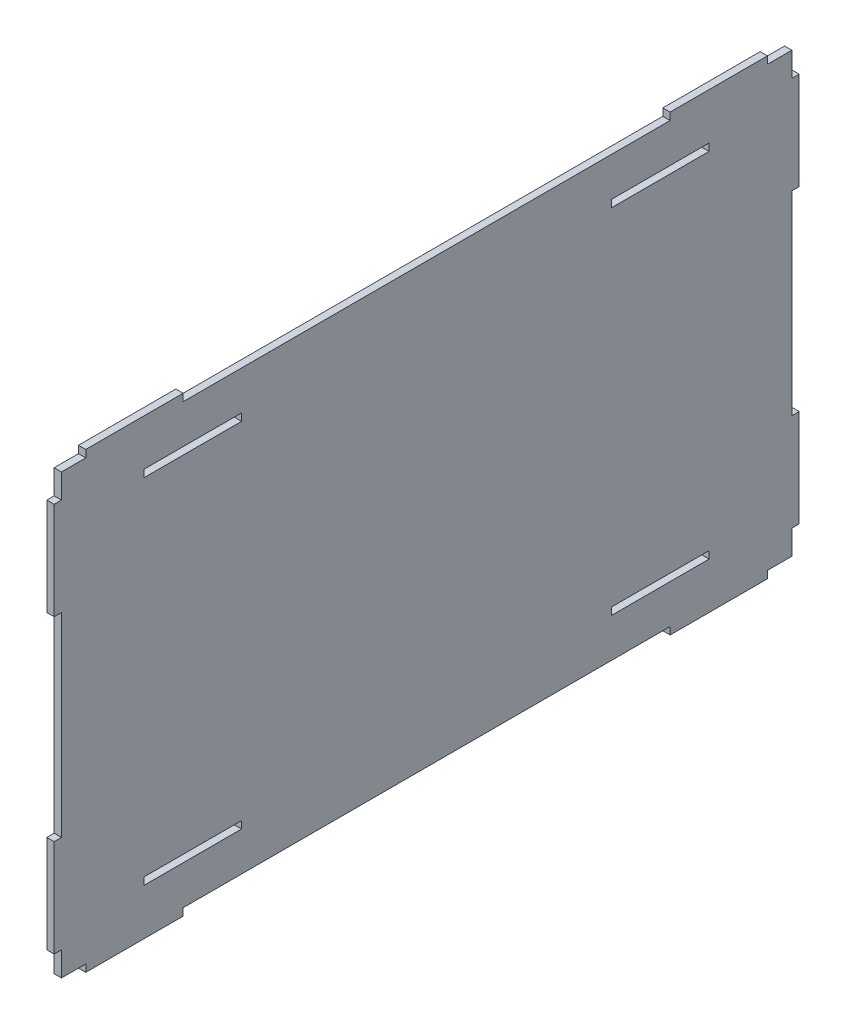
from build123d import *

# Parameters (mm, degrees)
SKETCH1_W           = 300
SKETCH1_H           = 180
BOSS_EXTRUDE1_DEPTH = 3
SKETCH2_W           = 40
SKETCH2_H           = 3
SKETCH2_W_2         = 3
SKETCH2_H_2         = 40
BOSS_EXTRUDE2_DEPTH = 3
SKETCH3_W           = 40
SKETCH3_H           = 3
CUT_EXTRUDE1_DEPTH  = 354.987287907
SKETCH4_W           = 40
SKETCH4_H           = 3
CUT_EXTRUDE2_DEPTH  = 3
SKETCH5_W           = 40
SKETCH5_H           = 3
CUT_EXTRUDE3_DEPTH  = 3
SKETCH6_W           = 40
SKETCH6_H           = 3
CUT_EXTRUDE4_DEPTH  = 3


with BuildPart() as part:
    # Sketch1 → Boss-Extrude1 (new body)
    with BuildSketch(Plane(origin=(0, 0, 0), x_dir=(0, 0, -1), z_dir=(1, 0, 0))):
        with Locations((-150, 90)):
            Rectangle(SKETCH1_W, SKETCH1_H)
    extrude(amount=BOSS_EXTRUDE1_DEPTH)

    # Sketch2 → Boss-Extrude2 (add)
    with BuildSketch(Plane(origin=(3, 0, 0), x_dir=(0, 0, -1), z_dir=(1, 0, 0))):
        with Locations((-270, 181.5)):
            Rectangle(SKETCH2_W, SKETCH2_H)
        with Locations((-30, 181.5)):
            Rectangle(SKETCH2_W, SKETCH2_H)
        with Locations((1.5, 150)):
            Rectangle(SKETCH2_W_2, SKETCH2_H_2)
        with Locations((1.5, 30)):
            Rectangle(SKETCH2_W_2, SKETCH2_H_2)
        with Locations((-30, -1.5)):
            Rectangle(SKETCH2_W, SKETCH2_H)
        with Locations((-270, -1.5)):
            Rectangle(SKETCH2_W, SKETCH2_H)
        with Locations((-301.5, 150)):
            Rectangle(SKETCH2_W_2, SKETCH2_H_2)
        with Locations((-301.5, 30)):
            Rectangle(SKETCH2_W_2, SKETCH2_H_2)
    extrude(amount=-BOSS_EXTRUDE2_DEPTH)

    # Sketch3 → Cut-Extrude1 (cut, through all)
    with BuildSketch(Plane(origin=(3, 0, 0), x_dir=(0, 0, -1), z_dir=(1, 0, 0))):
        with Locations((-246, 162.5)):
            Rectangle(SKETCH3_W, SKETCH3_H)
    extrude(amount=-CUT_EXTRUDE1_DEPTH, mode=Mode.SUBTRACT)

    # Sketch4 → Cut-Extrude2 (cut)
    with BuildSketch(Plane(origin=(3, 0, 0), x_dir=(0, 0, -1), z_dir=(1, 0, 0))):
        with Locations((-54, 162.5)):
            Rectangle(SKETCH4_W, SKETCH4_H)
    extrude(amount=-CUT_EXTRUDE2_DEPTH, mode=Mode.SUBTRACT)

    # Sketch5 → Cut-Extrude3 (cut)
    with BuildSketch(Plane(origin=(3, 0, 0), x_dir=(0, 0, -1), z_dir=(1, 0, 0))):
        with Locations((-246, 17.5)):
            Rectangle(SKETCH5_W, SKETCH5_H)
    extrude(amount=-CUT_EXTRUDE3_DEPTH, mode=Mode.SUBTRACT)

    # Sketch6 → Cut-Extrude4 (cut)
    with BuildSketch(Plane(origin=(3, 0, 0), x_dir=(0, 0, -1), z_dir=(1, 0, 0))):
        with Locations((-54, 17.5)):
            Rectangle(SKETCH6_W, SKETCH6_H)
    extrude(amount=-CUT_EXTRUDE4_DEPTH, mode=Mode.SUBTRACT)


solid = part.part
